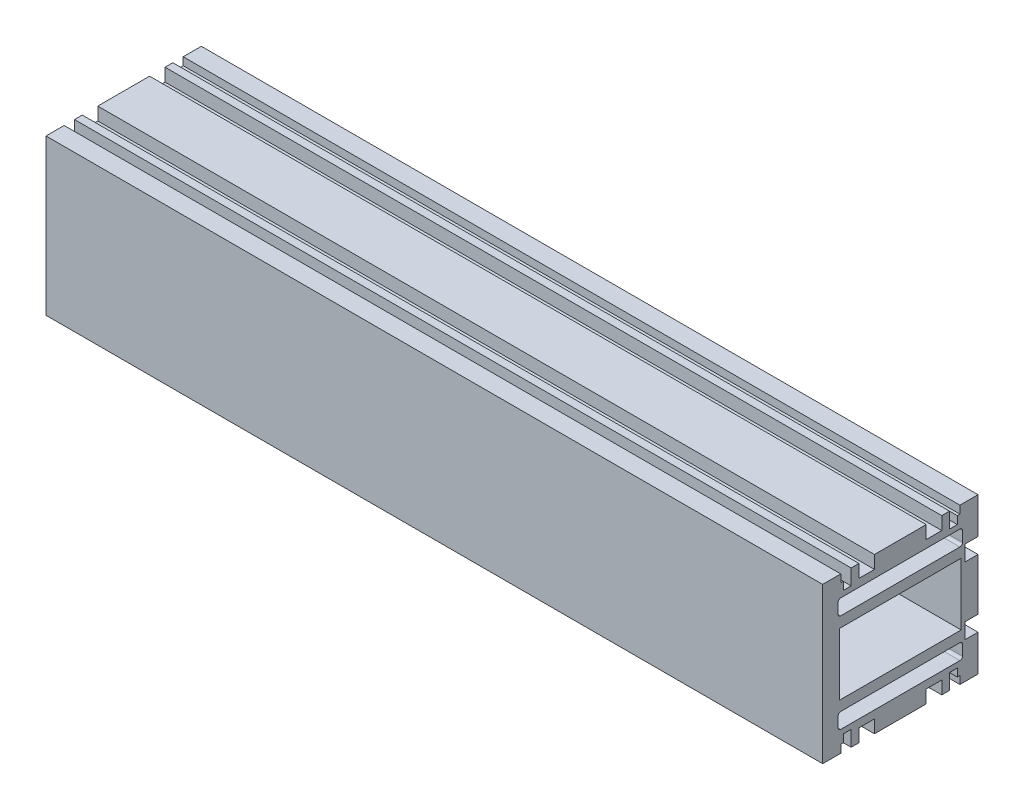
from build123d import *

# Parameters (mm, degrees)
SKETCH_1_W             = 23.5
SKETCH_1_H             = 12
EXTRUDE_1_DEPTH        = 75
HOLE_WIZARD_M6_1_D     = 5
HOLE_WIZARD_M6_1_DEPTH = 19
HOLE_WIZARD_M6_1_TIP   = 1.502151548
HOLE_WIZARD_M6_2_D     = 5
HOLE_WIZARD_M6_2_DEPTH = 19
HOLE_WIZARD_M6_2_TIP   = 1.502151548


with BuildPart() as part:
    # 草图1 → 凸台-拉伸1 (new, symmetric)
    with BuildSketch(Plane(origin=(0, 0, 0), x_dir=(0, 0, -1), z_dir=(1, 0, 0))):
        Polygon((-15, 15), (-11.5, 15), (-11.5, 13.5), (-11, 13.5), (-11, 12), (-9.5, 12), (-9.5, 15), (-8, 15), (-8, 12.5), (-5, 12.5), (-5, 15), (5, 15), (5, 12.5), (8, 12.5), (8, 15), (9.5, 15), (9.5, 12), (11, 12), (11, 13.5), (11.5, 13.5), (11.5, 15), (15, 15), (15, 8), (12.5, 8), (12.5, 5), (15, 5), (15, -5), (12.5, -5), (12.5, -8), (15, -8), (15, -15), (11.5, -15), (11.5, -13.5), (11, -13.5), (11, -12), (9.5, -12), (9.5, -15), (8, -15), (8, -12.5), (5, -12.5), (5, -15), (-5, -15), (-5, -12.5), (-8, -12.5), (-8, -15), (-9.5, -15), (-9.5, -12), (-11, -12), (-11, -13.5), (-11.5, -13.5), (-11.5, -15), (-15, -15), align=None)
        with BuildLine():
            Line((12, -10.5), (12, -8.5))
            ThreePointArc((12, -8.5), (11.853553391, -8.146446609), (11.5, -8))
            Line((11.5, -8), (-11.5, -8))
            ThreePointArc((-11.5, -8), (-11.853553391, -8.146446609), (-12, -8.5))
            Line((-12, -8.5), (-12, -10.5))
            ThreePointArc((-12, -10.5), (-11.853553391, -10.853553391), (-11.5, -11))
            Line((-11.5, -11), (11.5, -11))
            ThreePointArc((11.5, -11), (11.853553391, -10.853553391), (12, -10.5))
        make_face(mode=Mode.SUBTRACT)
        with BuildLine():
            Line((-11.5, 11), (11.5, 11))
            ThreePointArc((11.5, 11), (11.853553391, 10.853553391), (12, 10.5))
            Line((12, 10.5), (12, 8.5))
            ThreePointArc((12, 8.5), (11.853553391, 8.146446609), (11.5, 8))
            Line((11.5, 8), (-11.5, 8))
            ThreePointArc((-11.5, 8), (-11.853553391, 8.146446609), (-12, 8.5))
            Line((-12, 8.5), (-12, 10.5))
            ThreePointArc((-12, 10.5), (-11.853553391, 10.853553391), (-11.5, 11))
        make_face(mode=Mode.SUBTRACT)
        Rectangle(SKETCH_1_W, SKETCH_1_H, mode=Mode.SUBTRACT)
    extrude(amount=EXTRUDE_1_DEPTH, both=True)

    # M6 螺纹孔1
    with Locations(Plane(origin=(0, -15, 0), x_dir=(-1, 0, 0), z_dir=(0, -1, 0))):
        with Locations((-55, 0), (-40, 0), (55, 0), (40, 0)):
            Hole(HOLE_WIZARD_M6_1_D / 2, depth=HOLE_WIZARD_M6_1_DEPTH)
            with Locations((0, 0, -(HOLE_WIZARD_M6_1_DEPTH + HOLE_WIZARD_M6_1_TIP / 2))):  # 118° drill point
                Cone(0, HOLE_WIZARD_M6_1_D / 2, HOLE_WIZARD_M6_1_TIP, mode=Mode.SUBTRACT)

    # M6 螺纹孔2
    with Locations(Plane(origin=(0, 0, -15), x_dir=(-1, 0, 0), z_dir=(0, 0, -1))):
        with Locations((-55, 0), (-40, 0), (40, 0), (55, 0), (-4, 0), (4, 0)):
            Hole(HOLE_WIZARD_M6_2_D / 2, depth=HOLE_WIZARD_M6_2_DEPTH)
            with Locations((0, 0, -(HOLE_WIZARD_M6_2_DEPTH + HOLE_WIZARD_M6_2_TIP / 2))):  # 118° drill point
                Cone(0, HOLE_WIZARD_M6_2_D / 2, HOLE_WIZARD_M6_2_TIP, mode=Mode.SUBTRACT)


solid = part.part
